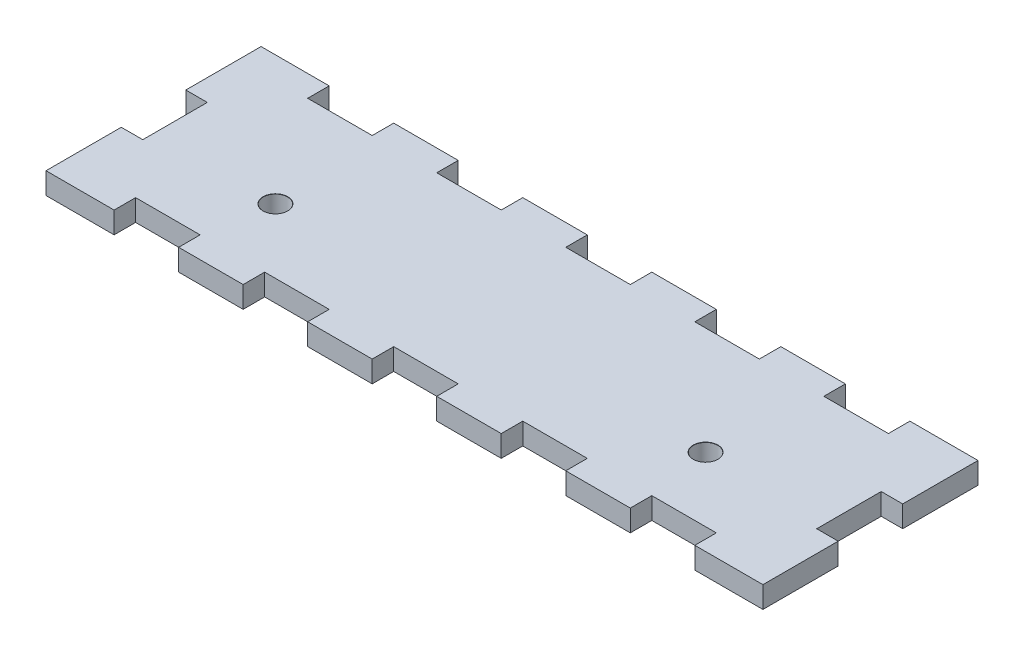
from build123d import *

# Parameters (mm, degrees)
BOSS_EXTRUDE1_DEPTH            = 1.5
M3_CLEARANCE_HOLE1_D           = 3.4
M3_CLEARANCE_HOLE1_CSINK_D     = 3.45
M3_CLEARANCE_HOLE1_CSINK_ANGLE = 90


with BuildPart() as part:
    # Sketch1 → Boss-Extrude1 (new, symmetric)
    with BuildSketch(Plane(origin=(0, 0, 0), x_dir=(1, 0, 0), z_dir=(0, 1, 0))):
        Polygon((50, 15), (47, 15), (40.5, 15), (40.5, 12), (31.5, 12), (31.5, 15), (22.5, 15), (22.5, 12), (13.5, 12), (13.5, 15), (4.5, 15), (4.5, 12), (-4.5, 12), (-4.5, 15), (-13.5, 15), (-13.5, 12), (-22.5, 12), (-22.5, 15), (-31.5, 15), (-31.5, 12), (-40.5, 12), (-40.5, 15), (-47, 15), (-50, 15), (-50, 12), (-50, 4.5), (-47, 4.5), (-47, -4.5), (-50, -4.5), (-50, -12), (-50, -15), (-47, -15), (-40.5, -15), (-40.5, -12), (-31.5, -12), (-31.5, -15), (-22.5, -15), (-22.5, -12), (-13.5, -12), (-13.5, -15), (-4.5, -15), (-4.5, -12), (4.5, -12), (4.5, -15), (13.5, -15), (13.5, -12), (22.5, -12), (22.5, -15), (31.5, -15), (31.5, -12), (40.5, -12), (40.5, -15), (47, -15), (50, -15), (50, -12), (50, -4.5), (47, -4.5), (47, 4.5), (50, 4.5), (50, 12), align=None)
    extrude(amount=BOSS_EXTRUDE1_DEPTH, both=True)

    # M3 Clearance Hole1 (through all)
    with Locations(Plane(origin=(0, 1.5, 0), x_dir=(1, 0, 0), z_dir=(0, 1, 0))):
        with Locations((-30, -3), (30, -3)):
            CounterSinkHole(M3_CLEARANCE_HOLE1_D / 2, M3_CLEARANCE_HOLE1_CSINK_D / 2, counter_sink_angle=M3_CLEARANCE_HOLE1_CSINK_ANGLE)


solid = part.part
